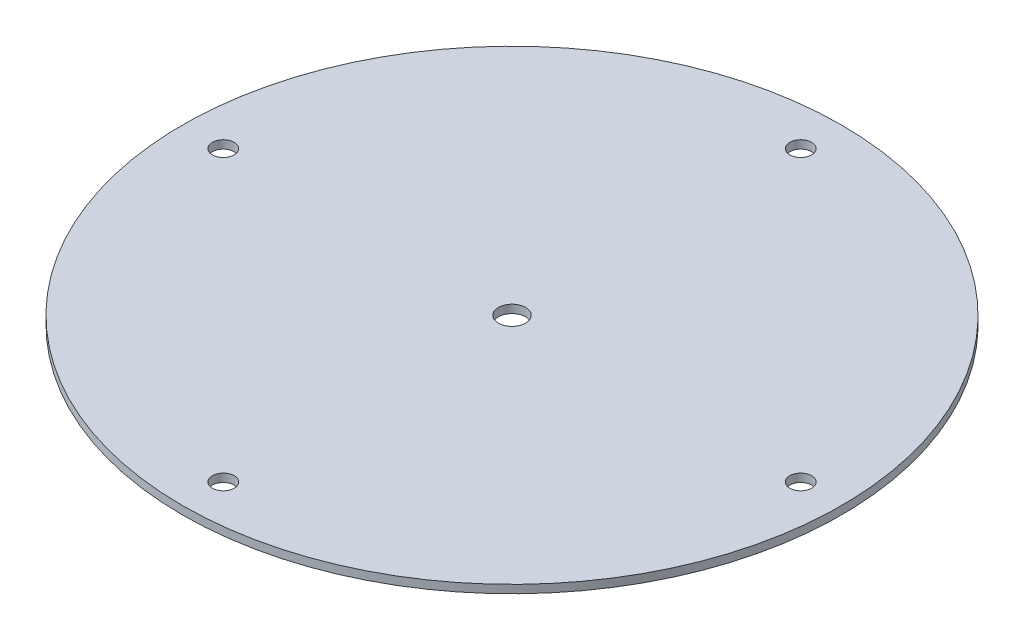
from build123d import *

# Parameters (mm, degrees)
SKETCH1_R           = 60.5
SKETCH1_R_2         = 2.5
BOSS_EXTRUDE1_DEPTH = 1.5
SKETCH2_R           = 2
CUT_EXTRUDE1_DEPTH  = 86.573068193


with BuildPart() as part:
    # Sketch1 → Boss-Extrude1 (new body)
    with BuildSketch(Plane(origin=(0, 0, 0), x_dir=(1, 0, 0), z_dir=(0, 1, 0))):
        with Locations(Location((0, 0, 0), (0, 0, 270))):
            Circle(SKETCH1_R)
        with Locations(Location((0, 0, 0), (0, 0, 270))):
            Circle(SKETCH1_R_2, mode=Mode.SUBTRACT)
    extrude(amount=BOSS_EXTRUDE1_DEPTH)

    # Sketch2 → Cut-Extrude1 (cut, through all)
    with BuildSketch(Plane(origin=(0, 1.5, 0), x_dir=(1, 0, 0), z_dir=(0, 1, 0))):
        with Locations(Location((0, 53, 0), (0, 0, 270))):
            Circle(SKETCH2_R)
        with Locations(Location((53, 0, 0), (0, 0, 270))):
            Circle(SKETCH2_R)
        with Locations(Location((0, -53, 0), (0, 0, 270))):
            Circle(SKETCH2_R)
        with Locations(Location((-53, 0, 0), (0, 0, 270))):
            Circle(SKETCH2_R)
    extrude(amount=-CUT_EXTRUDE1_DEPTH, mode=Mode.SUBTRACT)


solid = part.part
